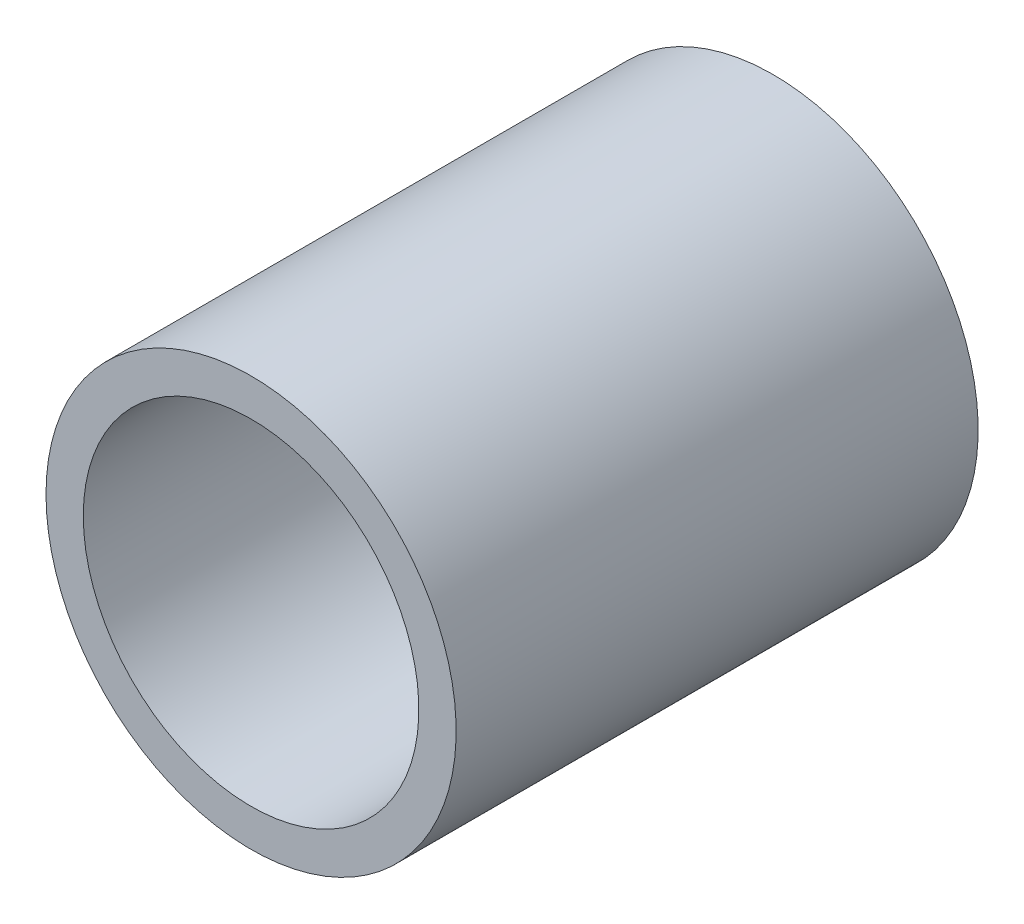
from build123d import *

# Parameters (mm, degrees)
BODY_SKETCH_R      = 5.5
BODY_SKETCH_R_2    = 4.5
BODY_EXTRUDE_DEPTH = 14


with BuildPart() as part:
    # Body Sketch → Body Extrude (new body)
    with BuildSketch(Plane.XY):
        with Locations(Location((0, 0, 0), (0, 0, 180))):
            Circle(BODY_SKETCH_R)
        with Locations(Location((0, 0, 0), (0, 0, 180))):
            Circle(BODY_SKETCH_R_2, mode=Mode.SUBTRACT)
    extrude(amount=BODY_EXTRUDE_DEPTH)


solid = part.part
